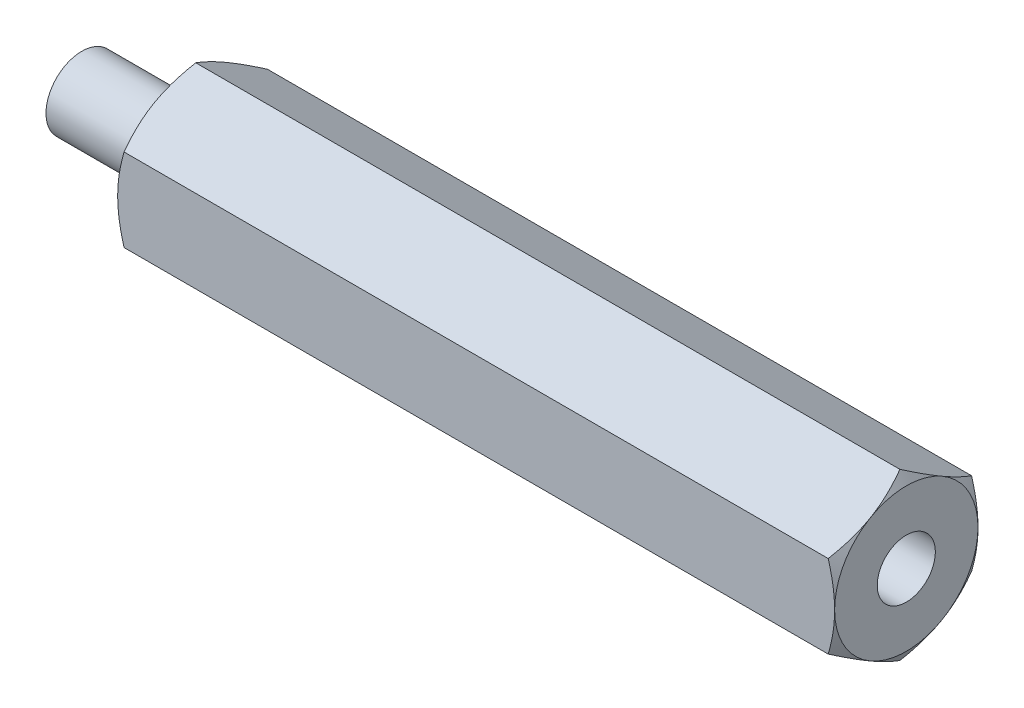
from build123d import *

# Parameters (mm, degrees)
BOSS_EXTRUDE1_DEPTH = 40
TAP4_D              = 3.242
TAP4_DEPTH          = 10.1
TAP4_TIP            = 0.973995063


with BuildPart() as part:
    # Sketch1 → Boss-Extrude1 (new body)
    with BuildSketch(Plane(origin=(0, 0, 0), x_dir=(0, 0, -1), z_dir=(1, 0, 0))):
        Polygon((0, 4.618802154), (-4, 2.309401077), (-4, -2.309401077), (0, -4.618802154), (4, -2.309401077), (4, 2.309401077), align=None)
    extrude(amount=BOSS_EXTRUDE1_DEPTH)

    # Sketch2 → Cut-Revolve1 (revolve, cut)
    with BuildSketch(Plane.XY):
        Polygon((0, 4.618802154), (0, 4), (0.35726559, 4.618802154), align=None)
        Polygon((39.64273441, 4.618802154), (40, 4.618802154), (40, 4), align=None)
    revolve(axis=Axis((0, 0, 0), (1, 0, 0)), mode=Mode.SUBTRACT)

    # Sketch11 → Revolve3 (revolve)
    with BuildSketch(Plane.XY):
        Polygon((0, 0), (0, 1.6), (-1.2, 1.6), (-1.2, 2), (-6, 2), (-6, 0), align=None)
    revolve(axis=Axis((0, 0, 0), (-1, 0, 0)))

    # Tap4
    with Locations(Plane(origin=(40, 0, 0), x_dir=(0, 0, -1), z_dir=(1, 0, 0))):
        with Locations((0, 0)):
            Hole(TAP4_D / 2, depth=TAP4_DEPTH)
            with Locations((0, 0, -(TAP4_DEPTH + TAP4_TIP / 2))):  # 118° drill point
                Cone(0, TAP4_D / 2, TAP4_TIP, mode=Mode.SUBTRACT)


solid = part.part
